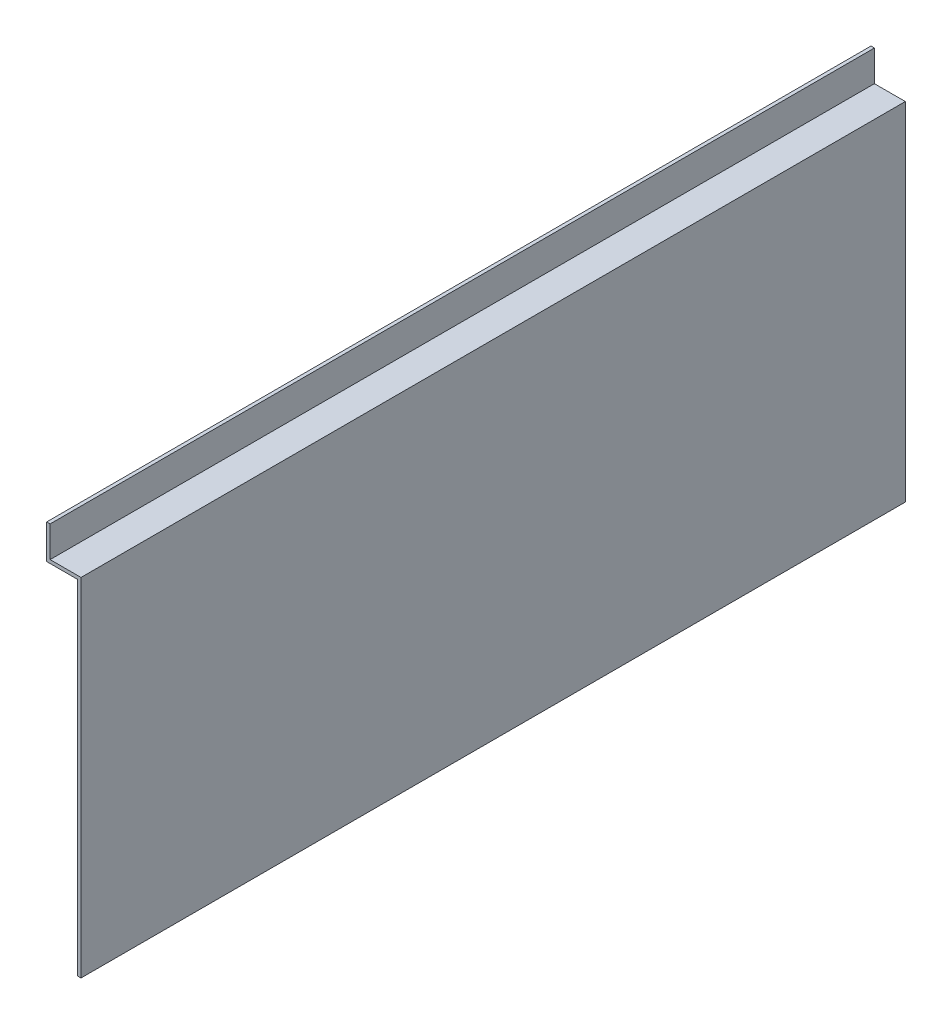
from build123d import *

# Parameters (mm, degrees)
EXTRUIR_L_MINA1_DEPTH = 240


with BuildPart() as part:
    # Croquis1 → Extruir-Lámina1 (new body)
    with BuildSketch(Plane.XY):
        Polygon((0, 0), (0, -10), (9, -10), (9, -110), (10, -110), (10, -9), (1, -9), (1, 0), align=None)
    extrude(amount=EXTRUIR_L_MINA1_DEPTH)


solid = part.part
